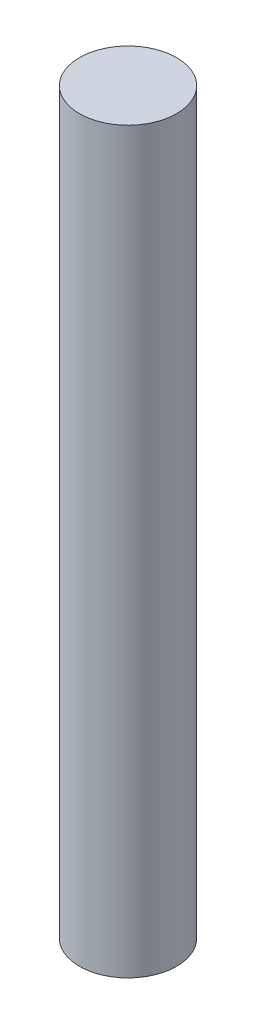
from build123d import *

# Parameters (mm, degrees)
SKETCH1_R           = 6.35
BOSS_EXTRUDE1_DEPTH = 96.52


with BuildPart() as part:
    # Sketch1 → Boss-Extrude1 (new body)
    with BuildSketch(Plane(origin=(0, 0, 0), x_dir=(1, 0, 0), z_dir=(0, 1, 0))):
        with Locations(Location((0, 0, 0), (0, 0, 90))):
            Circle(SKETCH1_R)
    extrude(amount=BOSS_EXTRUDE1_DEPTH)


solid = part.part
